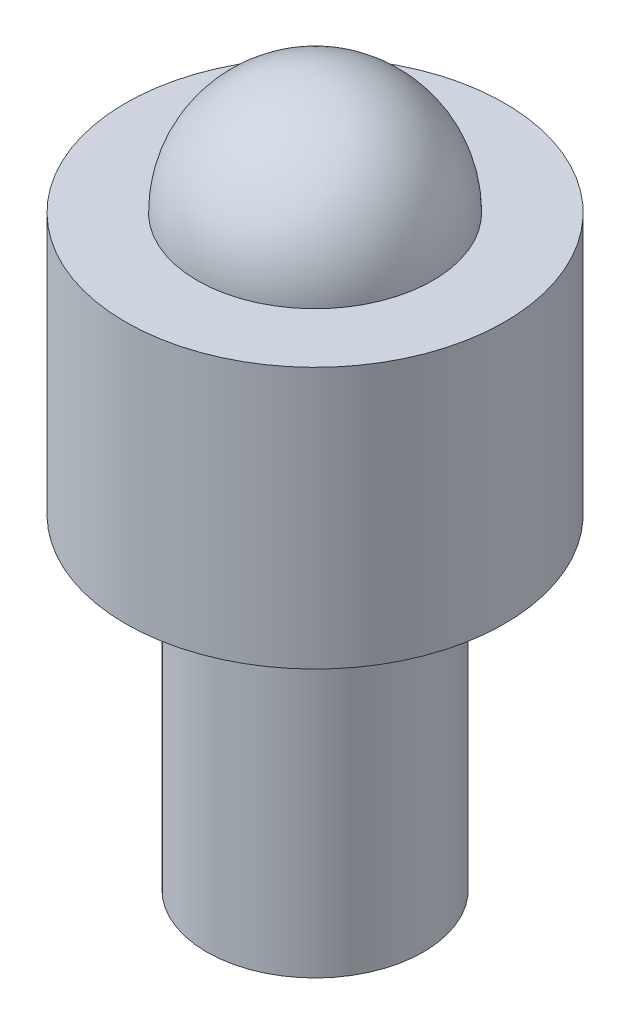
from build123d import *

# Parameters (mm, degrees)
SKETCH_1_R      = 4
EXTRUDE_1_DEPTH = 12
SKETCH_2_R      = 7
EXTRUDE_2_DEPTH = 9.65


with BuildPart() as part:
    # 草图1 → 凸台-拉伸1 (new body)
    with BuildSketch(Plane(origin=(0, 0, 0), x_dir=(1, 0, 0), z_dir=(0, 1, 0))):
        with Locations(Location((0, 0, 0), (0, 0, 270))):
            Circle(SKETCH_1_R)
    extrude(amount=EXTRUDE_1_DEPTH)

    # 草图2 → 凸台-拉伸2 (add)
    with BuildSketch(Plane(origin=(0, 12, 0), x_dir=(1, 0, 0), z_dir=(0, 1, 0))):
        with Locations(Location((0, 0, 0), (0, 0, 270))):
            Circle(SKETCH_2_R)
    extrude(amount=EXTRUDE_2_DEPTH)

    # 草图3 → 旋转1 (revolve)
    with BuildSketch(Plane(origin=(0, 21.65, 0), x_dir=(1, 0, 0), z_dir=(0, 1, 0))):
        with BuildLine():
            Line((0, 4.35), (0, -4.35))
            ThreePointArc((0, -4.35), (4.35, 0), (0, 4.35))
        make_face()
    revolve(axis=Axis((0, 21.65, -4.35), (0, 0, 1)))


solid = part.part
